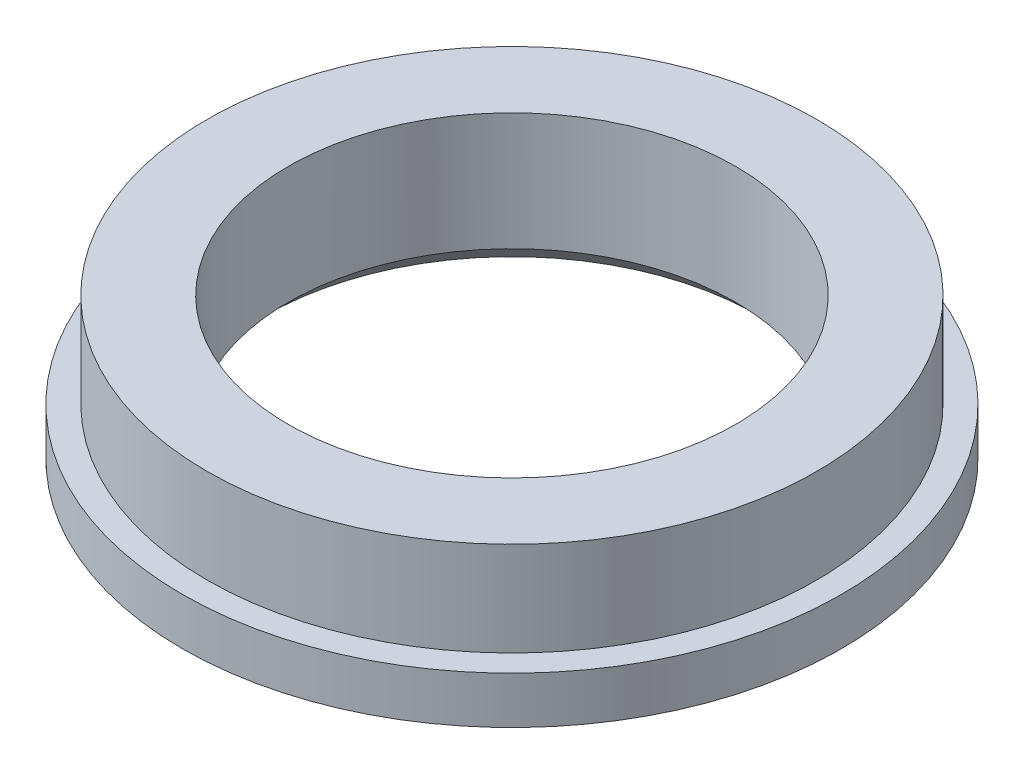
from build123d import *

# Parameters (mm, degrees)
SKETCH1_R           = 7
BOSS_EXTRUDE1_DEPTH = 1
SKETCH2_R           = 6.475
BOSS_EXTRUDE2_DEPTH = 2
SKETCH3_R           = 4.75
CUT_EXTRUDE1_DEPTH  = 11.344080433
CHAMFER1_SIZE       = 0.5


with BuildPart() as part:
    # Sketch1 → Boss-Extrude1 (new body)
    with BuildSketch(Plane(origin=(0, 0, 0), x_dir=(1, 0, 0), z_dir=(0, 1, 0))):
        with Locations(Location((0, 0, 0), (0, 0, 270))):
            Circle(SKETCH1_R)
    extrude(amount=BOSS_EXTRUDE1_DEPTH)

    # Sketch2 → Boss-Extrude2 (add)
    with BuildSketch(Plane(origin=(0, 1, 0), x_dir=(1, 0, 0), z_dir=(0, 1, 0))):
        with Locations(Location((0, 0, 0), (0, 0, 270))):
            Circle(SKETCH2_R)
    extrude(amount=BOSS_EXTRUDE2_DEPTH)

    # Sketch3 → Cut-Extrude1 (cut, through all)
    with BuildSketch(Plane.XZ):
        with Locations(Location((0, 0, 0), (0, 0, 270))):
            Circle(SKETCH3_R)
    extrude(amount=-CUT_EXTRUDE1_DEPTH, mode=Mode.SUBTRACT)

    # Chamfer1
    chamfer1_edges = [part.edges().sort_by_distance(p)[0] for p in [
        (0, 0, 4.75),
    ]]
    chamfer(chamfer1_edges, length=CHAMFER1_SIZE)


solid = part.part
